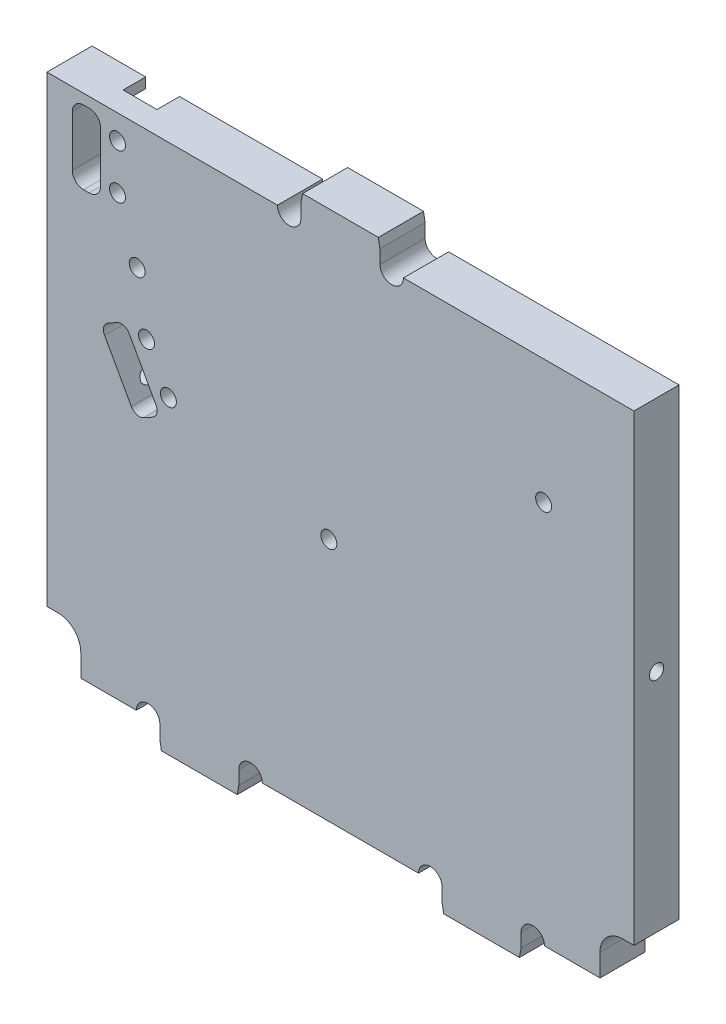
from build123d import *

# Parameters (mm, degrees)
SKETCH1_W                       = 165.1
SKETCH1_H                       = 142.875
BOSS_EXTRUDE1_DEPTH             = 12.7
BOSS_EXTRUDE2_DEPTH             = 12.7
CUT_EXTRUDE1_REACH              = 116.135
BOSS_EXTRUDE3_DEPTH             = 12.7
CUT_EXTRUDE2_DEPTH              = 12.7
F_21_0_159_DIAMETER_HOLE1_D     = 4.0386
F_21_0_159_DIAMETER_HOLE1_DEPTH = 22.225
F_21_0_159_DIAMETER_HOLE1_TIP   = 1.213317848
F_21_0_159_DIAMETER_HOLE2_D     = 4.0386
F_21_0_159_DIAMETER_HOLE2_DEPTH = 22.225
F_21_0_159_DIAMETER_HOLE2_TIP   = 1.213317848
SKETCH21_R                      = 4.7625
SKETCH21_R_2                    = 3.175
CUT_EXTRUDE10_DEPTH             = 6.35
F_8_CLEARANCE_HOLE1_D           = 4.4958
F_8_CLEARANCE_HOLE1_DEPTH       = 19.05
F_8_CLEARANCE_HOLE1_TIP         = 1.350674586
SKETCH24_W                      = 9.525
SKETCH24_H                      = 12.7
CUT_EXTRUDE11_DEPTH             = 115.134515622
FILLET1_R                       = 6.35
SKETCH29_W                      = 9.525
SKETCH29_H                      = 26.350000132
CUT_EXTRUDE12_DEPTH             = 6.35
FILLET2_R                       = 3.175
F_8_CLEARANCE_HOLE2_D           = 4.4958
SKETCH32_W                      = 7.9375
SKETCH32_H                      = 20.6375
CUT_EXTRUDE13_DEPTH             = 115.134515622
CUT_EXTRUDE14_START             = -6.35
CUT_EXTRUDE14_DEPTH             = 6.35
FILLET3_R                       = 3.175
CUT_EXTRUDE15_DEPTH             = 6.35
F_8_CLEARANCE_HOLE3_D           = 4.4958
CUT_EXTRUDE16_DEPTH             = 115.134515622
FILLET4_R                       = 2.54


with BuildPart() as part:
    # Sketch1 → Boss-Extrude1 (new body)
    with BuildSketch(Plane.XY):
        Rectangle(SKETCH1_W, SKETCH1_H)
    extrude(amount=BOSS_EXTRUDE1_DEPTH)

    # Sketch2 → Boss-Extrude2 (add)
    with BuildSketch(Plane.XY.offset(12.7)):
        Polygon((-11.1125, 71.4375), (11.1125, 71.4375), (11.1125, 75.2475), (10.664629469, 77.7875), (-10.664629469, 77.7875), (-11.1125, 75.2475), align=None)
    extrude(amount=-BOSS_EXTRUDE2_DEPTH)

    # Sketch4 → Cut-Extrude1 (cut, up to next)
    with BuildSketch(Plane.XY.offset(12.7), mode=Mode.PRIVATE) as cut_extrude1_sk1:
        with BuildLine():
            Line((-17.7165, 71.4375), (-11.1125, 71.4375))
            ThreePointArc((-11.1125, 71.4375), (-14.4145, 68.1355), (-17.7165, 71.4375))
        make_face()
    cut_extrude1_tool1 = extrude(cut_extrude1_sk1.sketch, amount=-CUT_EXTRUDE1_REACH, mode=Mode.PRIVATE) & part.part
    # Sketch4 → Cut-Extrude1 (cut, up to next)
    with BuildSketch(Plane.XY.offset(12.7), mode=Mode.PRIVATE) as cut_extrude1_sk2:
        with BuildLine():
            Line((11.1125, 71.4375), (17.7165, 71.4375))
            ThreePointArc((17.7165, 71.4375), (14.4145, 68.1355), (11.1125, 71.4375))
        make_face()
    cut_extrude1_tool2 = extrude(cut_extrude1_sk2.sketch, amount=-CUT_EXTRUDE1_REACH, mode=Mode.PRIVATE) & part.part
    add(cut_extrude1_tool1.solids().sort_by_distance((-14.4145, 70.036088, 12.7))[0], mode=Mode.SUBTRACT)
    add(cut_extrude1_tool2.solids().sort_by_distance((14.4145, 70.036088, 12.7))[0], mode=Mode.SUBTRACT)

    # Sketch5 → Boss-Extrude3 (add)
    with BuildSketch(Plane.XY.offset(12.7)):
        Polygon((50.8, -71.4375), (28.575, -71.4375), (28.575, -75.2475), (29.022870531, -77.7875), (50.352129469, -77.7875), (50.8, -75.2475), align=None)
    boss_extrude3 = extrude(amount=-BOSS_EXTRUDE3_DEPTH)

    # Sketch6 → Cut-Extrude2 (cut)
    with BuildSketch(Plane.XY.offset(12.7)):
        with BuildLine():
            Line((21.971, -71.4375), (28.575, -71.4375))
            ThreePointArc((28.575, -71.4375), (25.273, -68.1355), (21.971, -71.4375))
        make_face()
        with BuildLine():
            Line((50.8, -71.4375), (57.404, -71.4375))
            ThreePointArc((57.404, -71.4375), (54.102, -68.1355), (50.8, -71.4375))
        make_face()
    cut_extrude2 = extrude(amount=-CUT_EXTRUDE2_DEPTH, mode=Mode.SUBTRACT)

    # Mirror1: Boss-Extrude3, Cut-Extrude2 across plane
    add(boss_extrude3.mirror(Plane(origin=(0, 0, 0), x_dir=(0, 0, 1), z_dir=(1, 0, 0))))
    add(cut_extrude2.mirror(Plane(origin=(0, 0, 0), x_dir=(0, 0, 1), z_dir=(1, 0, 0))), mode=Mode.SUBTRACT)

    # #21 (0.159) Diameter Hole1
    with Locations(Plane(origin=(82.55, 0, 0), x_dir=(0, 0, -1), z_dir=(1, 0, 0))):
        with Locations((-6.35, 4.7625)):
            Hole(F_21_0_159_DIAMETER_HOLE1_D / 2, depth=F_21_0_159_DIAMETER_HOLE1_DEPTH)
            with Locations((0, 0, -(F_21_0_159_DIAMETER_HOLE1_DEPTH + F_21_0_159_DIAMETER_HOLE1_TIP / 2))):  # 118° drill point
                Cone(0, F_21_0_159_DIAMETER_HOLE1_D / 2, F_21_0_159_DIAMETER_HOLE1_TIP, mode=Mode.SUBTRACT)

    # #21 (0.159) Diameter Hole2
    with Locations(Plane.ZY.offset(82.55)):
        with Locations((6.35, 4.7625)):
            Hole(F_21_0_159_DIAMETER_HOLE2_D / 2, depth=F_21_0_159_DIAMETER_HOLE2_DEPTH)
            with Locations((0, 0, -(F_21_0_159_DIAMETER_HOLE2_DEPTH + F_21_0_159_DIAMETER_HOLE2_TIP / 2))):  # 118° drill point
                Cone(0, F_21_0_159_DIAMETER_HOLE2_D / 2, F_21_0_159_DIAMETER_HOLE2_TIP, mode=Mode.SUBTRACT)

    # Sketch21 → Cut-Extrude10 (cut)
    with BuildSketch(Plane(origin=(0, 0, 0), x_dir=(-1, 0, 0), z_dir=(0, 0, -1))):
        with Locations((-57.15, 36.5125)):
            Circle(SKETCH21_R)
        with Locations((57.15, 36.5125)):
            Circle(SKETCH21_R)
        with Locations((3.263048163, -2.752650538)):
            Circle(SKETCH21_R_2)
    extrude(amount=-CUT_EXTRUDE10_DEPTH, mode=Mode.SUBTRACT)

    # #8 Clearance Hole1
    with Locations(Plane(origin=(0, 0, 0), x_dir=(-1, 0, 0), z_dir=(0, 0, -1))):
        with Locations((-57.15, 36.5125), (3.263048163, -2.752650538), (57.15, 36.5125)):
            Hole(F_8_CLEARANCE_HOLE1_D / 2, depth=F_8_CLEARANCE_HOLE1_DEPTH)
            with Locations((0, 0, -(F_8_CLEARANCE_HOLE1_DEPTH + F_8_CLEARANCE_HOLE1_TIP / 2))):  # 118° drill point
                Cone(0, F_8_CLEARANCE_HOLE1_D / 2, F_8_CLEARANCE_HOLE1_TIP, mode=Mode.SUBTRACT)

    # Sketch24 → Cut-Extrude11 (cut, through all)
    with BuildSketch(Plane.XY.offset(12.7)):
        with Locations((-77.7875, -65.0875)):
            Rectangle(SKETCH24_W, SKETCH24_H)
        with Locations((77.7875, -65.0875)):
            Rectangle(SKETCH24_W, SKETCH24_H)
    extrude(amount=-CUT_EXTRUDE11_DEPTH, mode=Mode.SUBTRACT)

    # Fillet1
    fillet1_edges = [part.edges().sort_by_distance(p)[0] for p in [
        (-73.025, -58.7375, 6.35),
        (73.025, -58.7375, 6.35),
    ]]
    fillet(fillet1_edges, radius=FILLET1_R)

    # Sketch29 → Cut-Extrude12 (cut)
    with BuildSketch(Plane(origin=(0, 0, 0), x_dir=(-1, 0, 0), z_dir=(0, 0, -1))):
        with Locations((62.70625, 58.262499934)):
            Rectangle(SKETCH29_W, SKETCH29_H)
    extrude(amount=-CUT_EXTRUDE12_DEPTH, mode=Mode.SUBTRACT)

    # Fillet2
    fillet2_edges = [part.edges().sort_by_distance(p)[0] for p in [
        (-57.94375, 45.087499868, 3.175),
        (-67.46875, 45.087499868, 3.175),
    ]]
    fillet(fillet2_edges, radius=FILLET2_R)

    # #8 Clearance Hole2 (through all)
    with Locations(Plane(origin=(0, 0, 6.35), x_dir=(-1, 0, 0), z_dir=(0, 0, -1))):
        with Locations((62.70625, 64.612499934), (62.70625, 51.912499934)):
            Hole(F_8_CLEARANCE_HOLE2_D / 2)

    # Sketch32 → Cut-Extrude13 (cut, through all)
    with BuildSketch(Plane(origin=(0, 0, 0), x_dir=(-1, 0, 0), z_dir=(0, 0, -1))):
        with Locations((71.4375, 58.262499934)):
            Rectangle(SKETCH32_W, SKETCH32_H)
    extrude(amount=-CUT_EXTRUDE13_DEPTH, mode=Mode.SUBTRACT)

    # Sketch33 → Cut-Extrude14 (cut)
    with BuildSketch(Plane(origin=(0, 0, 0), x_dir=(-1, 0, 0), z_dir=(0, 0, -1)).offset(CUT_EXTRUDE14_START)):
        with BuildLine():
            Line((67.46875, 47.943749934), (67.45270924, 47.943749934))
            ThreePointArc((67.45270924, 47.943749934), (67.464737274, 48.10292322), (67.46875, 48.262499868))
            Line((67.46875, 48.262499868), (67.46875, 47.943749934))
        make_face()
    extrude(amount=CUT_EXTRUDE14_DEPTH, mode=Mode.SUBTRACT)

    # Fillet3
    fillet3_edges = [part.edges().sort_by_distance(p)[0] for p in [
        (-67.46875, 47.943749934, 9.525),
        (-67.46875, 68.581249934, 9.525),
        (-75.40625, 68.581249934, 6.35),
        (-75.40625, 47.943749934, 6.35),
    ]]
    fillet(fillet3_edges, radius=FILLET3_R)

    # Sketch34 → Cut-Extrude15 (cut)
    with BuildSketch(Plane(origin=(0, 0, 0), x_dir=(-1, 0, 0), z_dir=(0, 0, -1))):
        Polygon((40.757720371, 5.302804118), (53.841519997, 28.906603465), (62.172272708, 24.288791832), (49.088473081, 0.684992485), align=None)
    extrude(amount=-CUT_EXTRUDE15_DEPTH, mode=Mode.SUBTRACT)

    # #8 Clearance Hole3 (through all)
    with Locations(Plane(origin=(0, 0, 6.35), x_dir=(-1, 0, 0), z_dir=(0, 0, -1))):
        with Locations((54.543537628, 20.349633115), (48.386455451, 9.241962835)):
            Hole(F_8_CLEARANCE_HOLE3_D / 2)

    # Sketch37 → Cut-Extrude16 (cut, through all)
    with BuildSketch(Plane(origin=(0, 0, 0), x_dir=(-1, 0, 0), z_dir=(0, 0, -1))):
        Polygon((60.633002164, 21.511874262), (67.575296089, 17.663697901), (57.570037551, -0.386266305), (50.627743626, 3.461910055), align=None)
    extrude(amount=-CUT_EXTRUDE16_DEPTH, mode=Mode.SUBTRACT)

    # Fillet4
    fillet4_edges = [part.edges().sort_by_distance(p)[0] for p in [
        (-49.088473081, 0.684992485, 3.175),
        (-40.757720371, 5.302804118, 3.175),
        (-53.841519997, 28.906603465, 3.175),
        (-62.172272708, 24.288791832, 3.175),
        (-67.575296089, 17.663697901, 6.35),
        (-50.627743626, 3.461910055, 9.525),
        (-57.570037551, -0.386266305, 6.35),
        (-60.633002164, 21.511874262, 9.525),
    ]]
    fillet(fillet4_edges, radius=FILLET4_R)


solid = part.part
